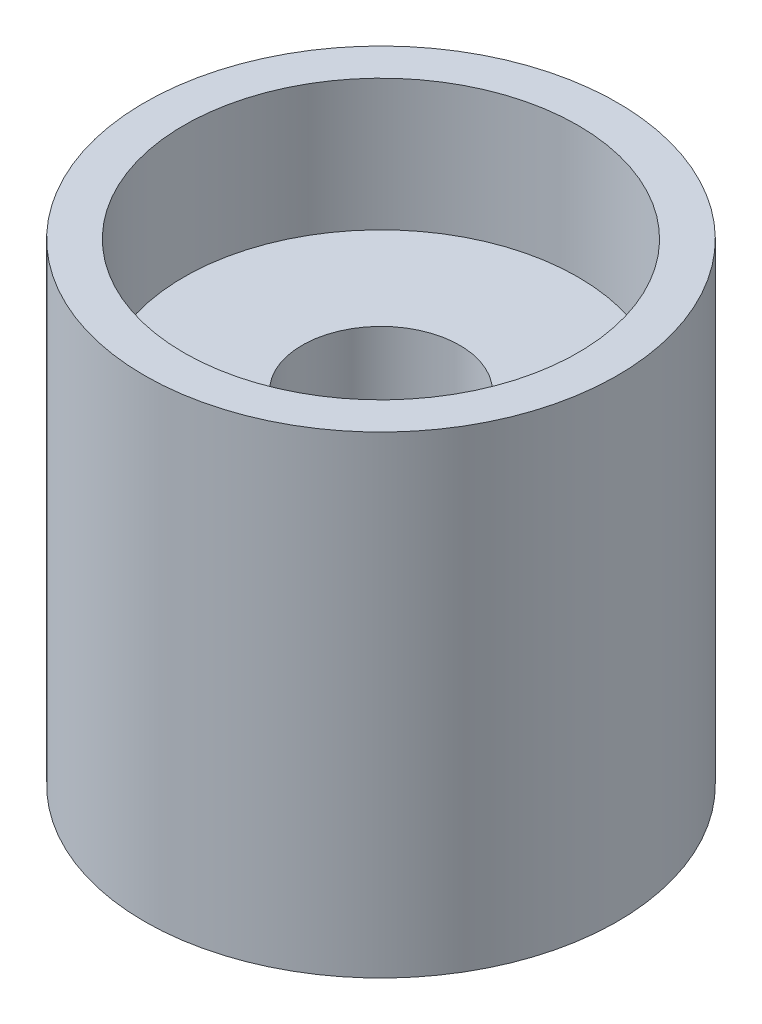
from build123d import *

# Parameters (mm, degrees)
SKETCH1_R           = 9
SKETCH1_R_2         = 7.5
BOSS_EXTRUDE1_DEPTH = 18
SKETCH2_R           = 7.5
SKETCH2_R_2         = 3
BOSS_EXTRUDE2_DEPTH = 4


with BuildPart() as part:
    # Sketch1 → Boss-Extrude1 (new body)
    with BuildSketch(Plane(origin=(0, 0, 0), x_dir=(1, 0, 0), z_dir=(0, 1, 0))):
        with Locations(Location((0, 0, 0), (0, 0, 270))):
            Circle(SKETCH1_R)
        with Locations(Location((0, 0, 0), (0, 0, 270))):
            Circle(SKETCH1_R_2, mode=Mode.SUBTRACT)
    extrude(amount=BOSS_EXTRUDE1_DEPTH)

    # Sketch2 → Boss-Extrude2 (add, symmetric)
    with BuildSketch(Plane(origin=(0, 9, 0), x_dir=(1, 0, 0), z_dir=(0, 1, 0))):
        with Locations(Location((0, 0, 0), (0, 0, 270))):
            Circle(SKETCH2_R)
        with Locations(Location((0, 0, 0), (0, 0, 270))):
            Circle(SKETCH2_R_2, mode=Mode.SUBTRACT)
    extrude(amount=BOSS_EXTRUDE2_DEPTH, both=True)


solid = part.part
